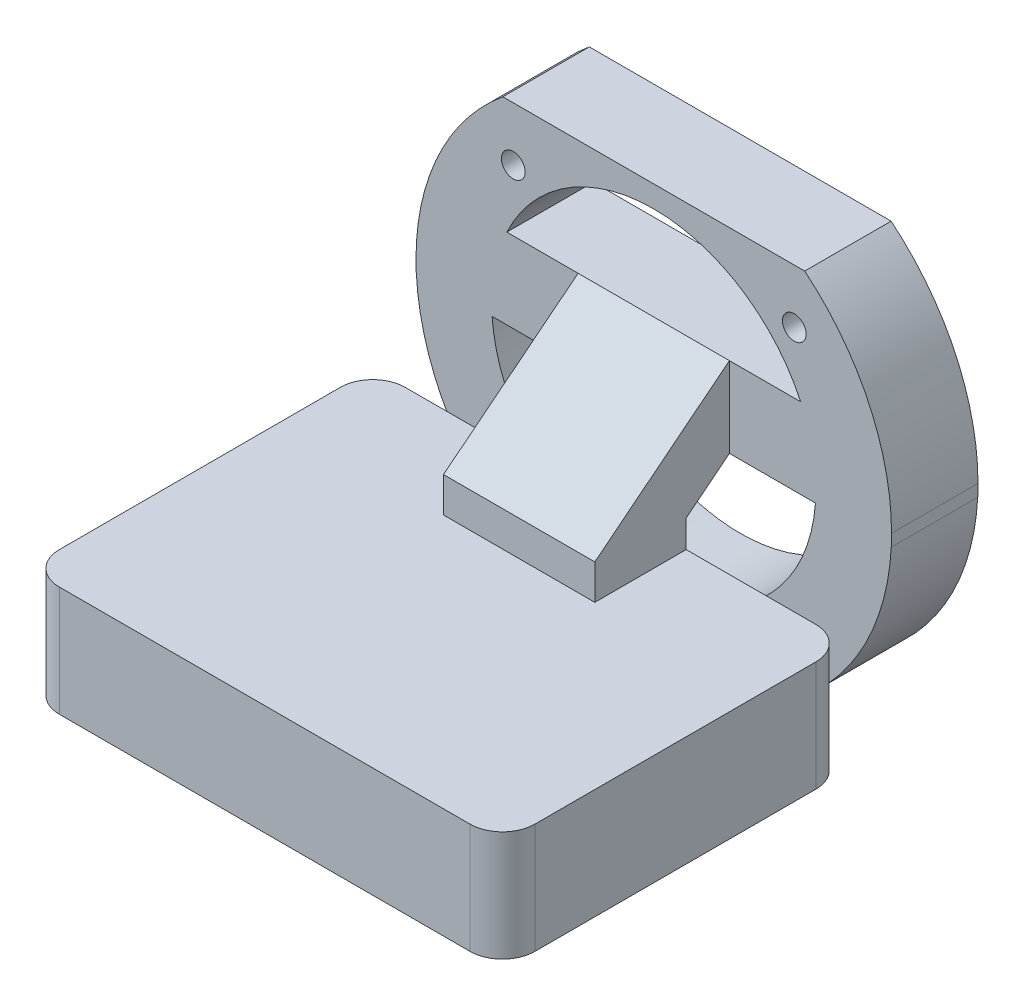
from build123d import *

# Parameters (mm, degrees)
SKETCH_1_R           = 15
SKETCH_1_R_2         = 1.1
EXTRUDE_1_DEPTH      = 8
EXTRUDE_2_DEPTH      = 22
EXTRUDE_2_DEPTH_BACK = 22
SKETCH_5_W           = 12.455474759
SKETCH_5_H           = 13.140065833
CUT_EXTRUDE_1_DEPTH  = 15
CUT_EXTRUDE_START    = -15
CUT_EXTRUDE_2_DEPTH  = 15
SKETCH_7_R           = 4
EXTRUDE_3_DEPTH      = 2
SKETCH_8_R           = 3
CUT_EXTRUDE_3_DEPTH  = 1
DOME_1_FACE_RADIUS   = 3
DOME_1_HEIGHT        = 1.5
FILLET_1_R           = 3


with BuildPart() as part:
    # 草图1 → 凸台-拉伸1 (new body)
    with BuildSketch(Plane.XY):
        with BuildLine():
            Line((13.964240044, -17), (-13.964240044, -17))
            ThreePointArc((-13.964240044, -17), (-22, 0), (-13.964240044, 17))
            Line((-13.964240044, 17), (13.964240044, 17))
            ThreePointArc((13.964240044, 17), (22, 0), (13.964240044, -17))
        make_face()
        Circle(SKETCH_1_R, mode=Mode.SUBTRACT)
        with Locations((-13, 12)):
            Circle(SKETCH_1_R_2, mode=Mode.SUBTRACT)
        with Locations((13, 12)):
            Circle(SKETCH_1_R_2, mode=Mode.SUBTRACT)
        with Locations((13, -12)):
            Circle(SKETCH_1_R_2, mode=Mode.SUBTRACT)
        with Locations((-13, -12)):
            Circle(SKETCH_1_R_2, mode=Mode.SUBTRACT)
    extrude(amount=EXTRUDE_1_DEPTH)

    # 草图3 → 凸台-拉伸2 (add, two sides: drawn at the far end of the back side and taken through both)
    with BuildSketch(Plane(origin=(0, 0, 0), x_dir=(0, 0, -1), z_dir=(1, 0, 0)).offset(-EXTRUDE_2_DEPTH_BACK)):
        Polygon((-12, -6.8), (-12, -4.272567443), (-8, -1.093373368), (0, -1.093373368), (0, 6.340065833), (-8, 6.340065833), (-20.455474759, -3.559527056), (-20.455474759, -6.8), (-44, -6.8), (-44, -17), (-12, -17), align=None)
    extrude(amount=EXTRUDE_2_DEPTH + EXTRUDE_2_DEPTH_BACK)

    # 草图5 → 切除-拉伸1 (cut)
    with BuildSketch(Plane.ZY.offset(22)):
        with Locations((14.22773738, -0.229967084)):
            Rectangle(SKETCH_5_W, SKETCH_5_H)
    cut_extrude_1 = extrude(amount=-CUT_EXTRUDE_1_DEPTH, mode=Mode.SUBTRACT)

    # 镜向1: 切除-拉伸1 across plane
    add(cut_extrude_1.mirror(Plane(origin=(0, 0, 0), x_dir=(0, 0, 1), z_dir=(1, 0, 0))), mode=Mode.SUBTRACT)

    # 草图6 → 切除-拉伸2 (cut)
    with BuildSketch(Plane.XY.offset(8).offset(CUT_EXTRUDE_START)):
        with BuildLine():
            Line((21.066645799, 6.340065833), (22, 6.340065833))
            Line((22, 6.340065833), (22, 0))
            ThreePointArc((22, 0), (21.76541072, 3.204199776), (21.066645799, 6.340065833))
        make_face()
        with BuildLine():
            Line((-21.066645799, 6.340065833), (-22, 6.340065833))
            Line((-22, 6.340065833), (-22, 0))
            ThreePointArc((-22, 0), (-21.76541072, 3.204199776), (-21.066645799, 6.340065833))
        make_face()
    extrude(amount=CUT_EXTRUDE_2_DEPTH, mode=Mode.SUBTRACT)

    # 草图7 → 凸台-拉伸3 (add)
    with BuildSketch(Plane.XZ.offset(17)):
        with Locations(Location((0, 28, 0), (0, 0, 90))):
            Circle(SKETCH_7_R)
    extrude(amount=EXTRUDE_3_DEPTH)

    # 草图8 → 切除-拉伸3 (cut)
    with BuildSketch(Plane.XZ.offset(19)):
        with Locations(Location((0, 28, 0), (0, 0, 270))):
            Circle(SKETCH_8_R)
    extrude(amount=-CUT_EXTRUDE_3_DEPTH, mode=Mode.SUBTRACT)

    # 圆顶1: a dome of height H over a round flat face of radius A is a cap of a sphere of radius (A * A + H * H) / (2 * H)
    dome_1_r = (DOME_1_FACE_RADIUS * DOME_1_FACE_RADIUS + DOME_1_HEIGHT * DOME_1_HEIGHT) / (2 * DOME_1_HEIGHT)
    dome_1_base = Plane((0, -18, 28), z_dir=(0, -1, 0))
    with Locations(dome_1_base.offset(DOME_1_HEIGHT - dome_1_r)):
        dome_1_ball = Sphere(dome_1_r, mode=Mode.PRIVATE)
    add(split(dome_1_ball, bisect_by=dome_1_base, keep=Keep.TOP, mode=Mode.PRIVATE))

    # 圆角1
    fillet_1_edges = [part.edges().sort_by_distance(p)[0] for p in [
        (-22, -11.9, 12),
        (-22, -11.9, 44),
        (22, -11.9, 12),
        (22, -11.9, 44),
    ]]
    fillet(fillet_1_edges, radius=FILLET_1_R)


solid = part.part
